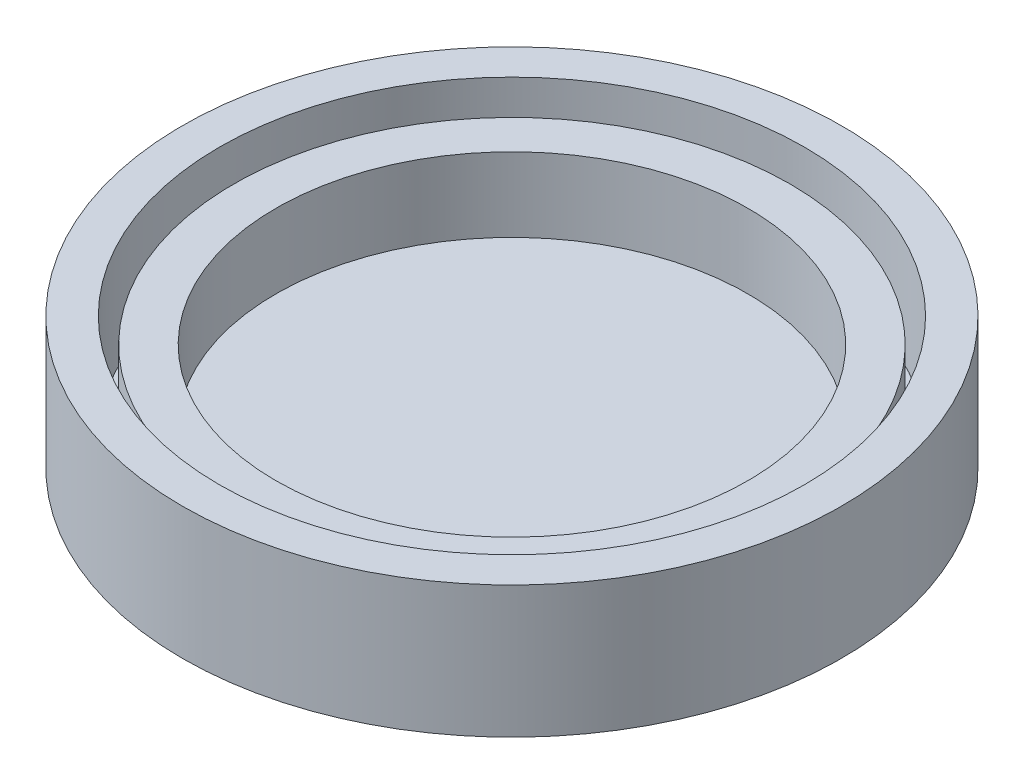
from build123d import *

# Parameters (mm, degrees)
SKETCH1_R           = 40
BOSS_EXTRUDE1_DEPTH = 13
SKETCH3_R           = 35
CUT_EXTRUDE1_DEPTH  = 10
SKETCH4_R           = 33
BOSS_EXTRUDE2_DEPTH = 4
SKETCH7_R           = 40
SKETCH7_R_2         = 35
BOSS_EXTRUDE3_DEPTH = 3
SKETCH8_R           = 35.5
CUT_EXTRUDE2_DEPTH  = 13
SKETCH9_R           = 33.75
BOSS_EXTRUDE6_DEPTH = 7
SKETCH10_R          = 28.645528411
CUT_EXTRUDE3_DEPTH  = 6
SKETCH11_R          = 33.75
SKETCH11_R_2        = 28.645528411
BOSS_EXTRUDE8_DEPTH = 3


with BuildPart() as part:
    # Sketch1 → Boss-Extrude1 (new body)
    with BuildSketch(Plane(origin=(0, 0, 0), x_dir=(1, 0, 0), z_dir=(0, 1, 0))):
        with Locations(Location((0, 0, 0), (0, 0, 270))):
            Circle(SKETCH1_R)
    extrude(amount=BOSS_EXTRUDE1_DEPTH)

    # Sketch3 → Cut-Extrude1 (cut)
    with BuildSketch(Plane(origin=(0, 13, 0), x_dir=(1, 0, 0), z_dir=(0, 1, 0))):
        with Locations(Location((0, 0, 0), (0, 0, 270))):
            Circle(SKETCH3_R)
    extrude(amount=-CUT_EXTRUDE1_DEPTH, mode=Mode.SUBTRACT)

    # Sketch4 → Boss-Extrude2 (add)
    with BuildSketch(Plane(origin=(0, 3, 0), x_dir=(1, 0, 0), z_dir=(0, 1, 0))):
        with Locations(Location((0, 0, 0), (0, 0, 270))):
            Circle(SKETCH4_R)
    extrude(amount=BOSS_EXTRUDE2_DEPTH)

    # Sketch7 → Boss-Extrude3 (add)
    with BuildSketch(Plane(origin=(0, 13, 0), x_dir=(1, 0, 0), z_dir=(0, 1, 0))):
        with Locations(Location((0, 0, 0), (0, 0, 270))):
            Circle(SKETCH7_R)
        with Locations(Location((0, 0, 0), (0, 0, 270))):
            Circle(SKETCH7_R_2, mode=Mode.SUBTRACT)
    extrude(amount=BOSS_EXTRUDE3_DEPTH)

    # Sketch8 → Cut-Extrude2 (cut)
    with BuildSketch(Plane(origin=(0, 16, 0), x_dir=(1, 0, 0), z_dir=(0, 1, 0))):
        with Locations(Location((0, 0, 0), (0, 0, 270))):
            Circle(SKETCH8_R)
    extrude(amount=-CUT_EXTRUDE2_DEPTH, mode=Mode.SUBTRACT)

    # Sketch9 → Boss-Extrude6 (add)
    with BuildSketch(Plane(origin=(0, 3, 0), x_dir=(1, 0, 0), z_dir=(0, 1, 0))):
        with Locations(Location((0, 0, 0), (0, 0, 90))):
            Circle(SKETCH9_R)
    extrude(amount=BOSS_EXTRUDE6_DEPTH)

    # Sketch10 → Cut-Extrude3 (cut)
    with BuildSketch(Plane(origin=(0, 10, 0), x_dir=(1, 0, 0), z_dir=(0, 1, 0))):
        with Locations(Location((0, 0, 0), (0, 0, 270))):
            Circle(SKETCH10_R)
    extrude(amount=-CUT_EXTRUDE3_DEPTH, mode=Mode.SUBTRACT)

    # Sketch11 → Boss-Extrude8 (add)
    with BuildSketch(Plane(origin=(0, 10, 0), x_dir=(1, 0, 0), z_dir=(0, 1, 0))):
        with Locations(Location((0, 0, 0), (0, 0, 90))):
            Circle(SKETCH11_R)
        with Locations(Location((0, 0, 0), (0, 0, 270))):
            Circle(SKETCH11_R_2, mode=Mode.SUBTRACT)
    extrude(amount=BOSS_EXTRUDE8_DEPTH)


solid = part.part
